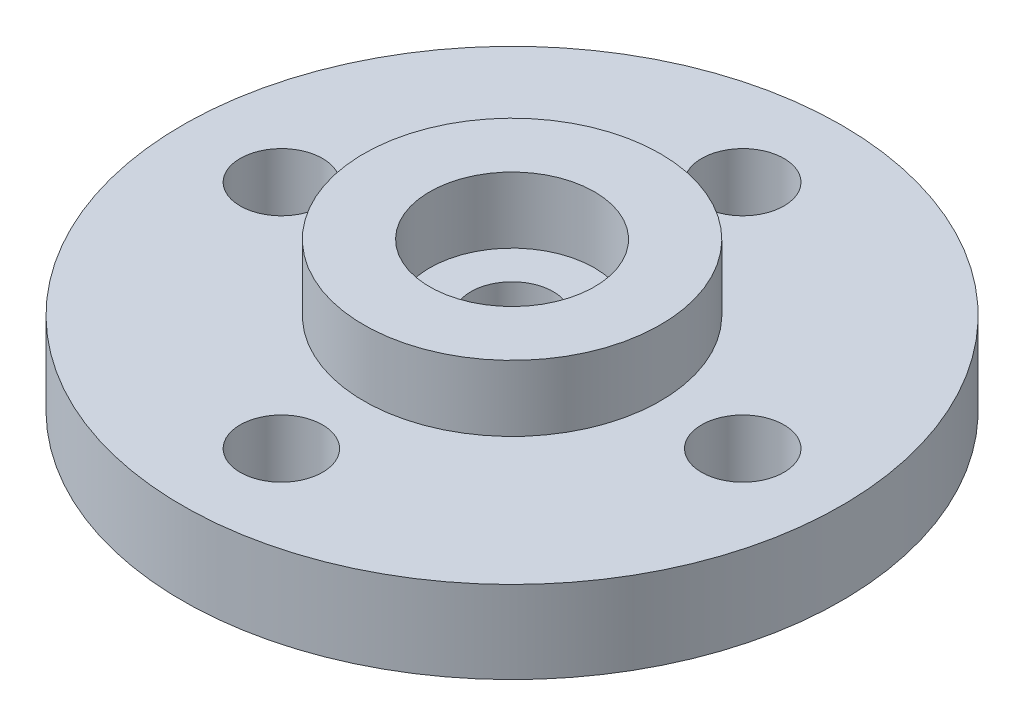
from build123d import *

# Parameters (mm, degrees)
TAP_DRILL_FOR_M3X0_5_TAP1_D = 2.5


with BuildPart() as part:
    # Sketch2 → Revolve1 (revolve)
    with BuildSketch(Plane.XY):
        Polygon((0, 2.5), (2.5, 2.5), (2.5, 4.5), (4.5, 4.5), (4.5, 2.5), (10, 2.5), (10, 0), (0, 0), align=None)
    revolve(axis=Axis((0, 0, 0), (0, 1, 0)))

    # Tap Drill for M3x0.5 Tap1 (through all)
    with Locations(Plane(origin=(0, 2.5, 0), x_dir=(1, 0, 0), z_dir=(0, 1, 0))):
        with Locations((0, 7), (0, -7), (-7, 0), (7, 0), (0, 0)):
            Hole(TAP_DRILL_FOR_M3X0_5_TAP1_D / 2)


solid = part.part
